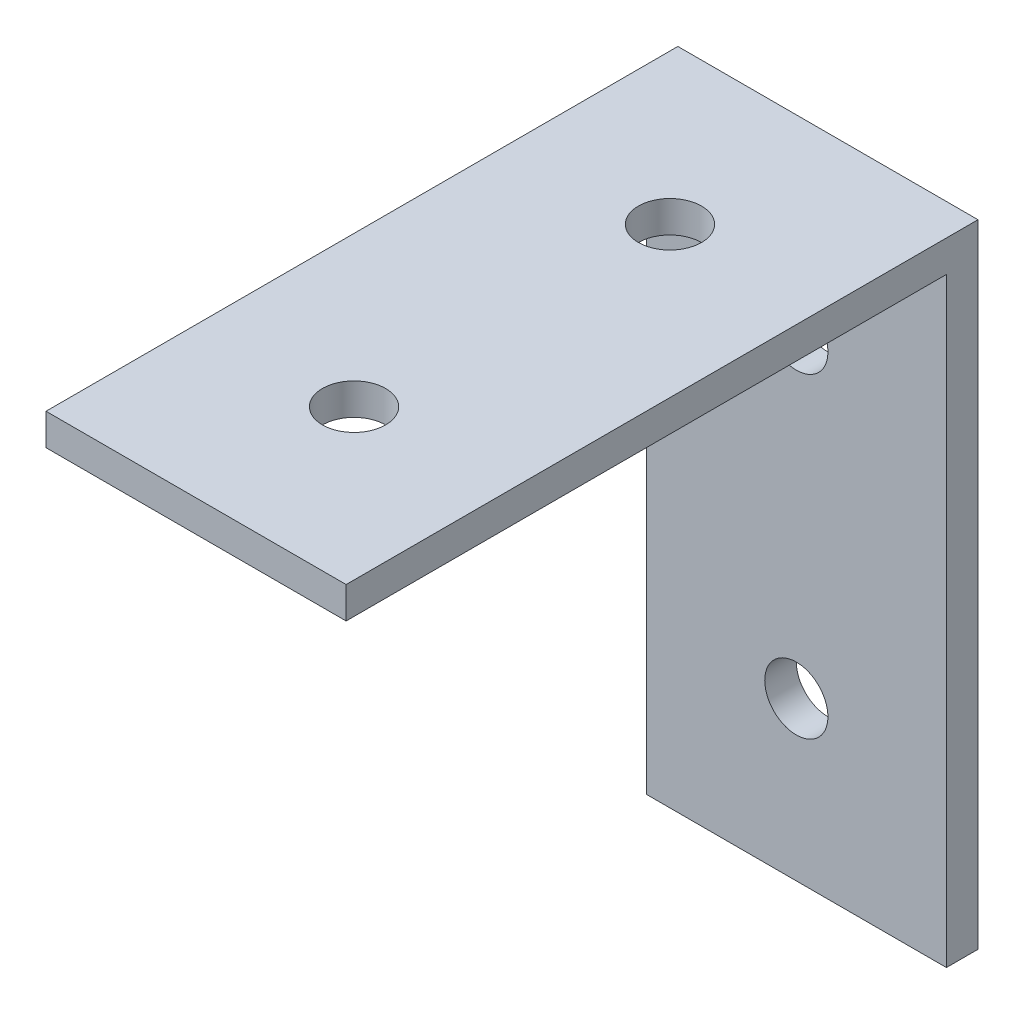
from build123d import *

# Parameters (mm, degrees)
SKETCH1_W           = 19
SKETCH1_H           = 40
BOSS_EXTRUDE1_DEPTH = 2
SKETCH2_W           = 19
SKETCH2_H           = 2
BOSS_EXTRUDE2_DEPTH = 38
SKETCH3_R           = 2
CUT_EXTRUDE1_DEPTH  = 10
SKETCH4_R           = 2
CUT_EXTRUDE2_DEPTH  = 10


with BuildPart() as part:
    # Sketch1 → Boss-Extrude1 (new body)
    with BuildSketch(Plane.XY):
        Rectangle(SKETCH1_W, SKETCH1_H)
    extrude(amount=BOSS_EXTRUDE1_DEPTH)

    # Sketch2 → Boss-Extrude2 (add)
    with BuildSketch(Plane.XY.offset(2)):
        with Locations((0, 19)):
            Rectangle(SKETCH2_W, SKETCH2_H)
    extrude(amount=BOSS_EXTRUDE2_DEPTH)

    # Sketch3 → Cut-Extrude1 (cut)
    with BuildSketch(Plane(origin=(0, 0, 0), x_dir=(-1, 0, 0), z_dir=(0, 0, -1))):
        with Locations((0, 10)):
            Circle(SKETCH3_R)
        with Locations((0, -10)):
            Circle(SKETCH3_R)
    extrude(amount=-CUT_EXTRUDE1_DEPTH, mode=Mode.SUBTRACT)

    # Sketch4 → Cut-Extrude2 (cut)
    with BuildSketch(Plane(origin=(0, 20, 0), x_dir=(1, 0, 0), z_dir=(0, 1, 0))):
        with Locations(Location((0, -10, 0), (0, 0, 270))):
            Circle(SKETCH4_R)
        with Locations(Location((0, -30, 0), (0, 0, 270))):
            Circle(SKETCH4_R)
    extrude(amount=-CUT_EXTRUDE2_DEPTH, mode=Mode.SUBTRACT)


solid = part.part
